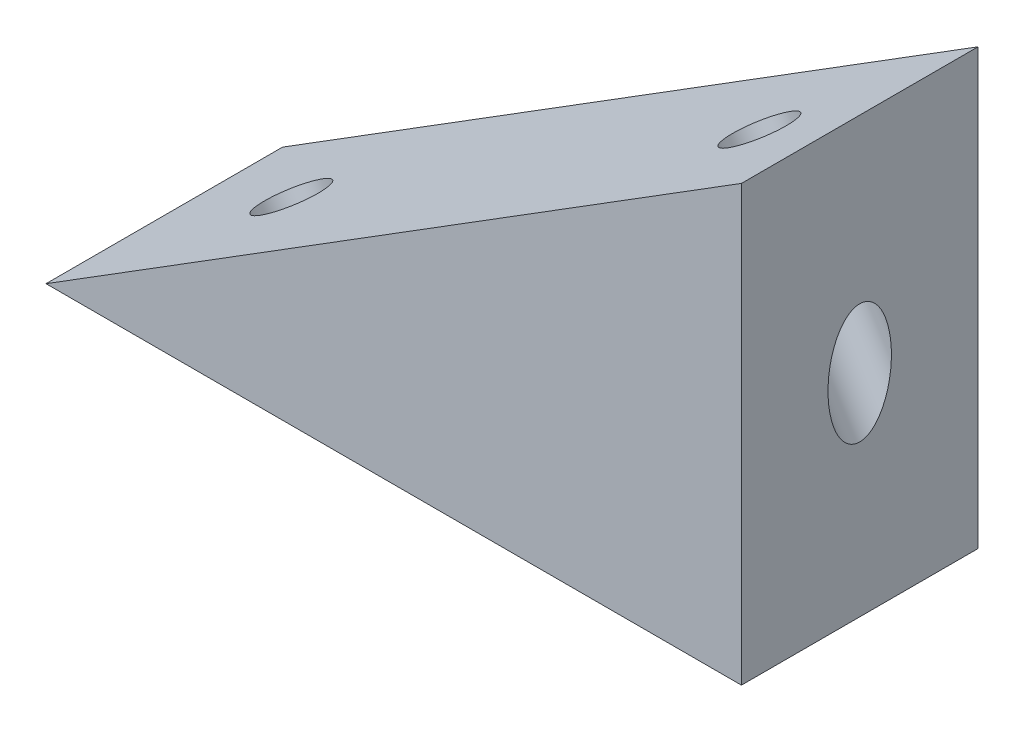
from build123d import *

# Parameters (mm, degrees)
BOSS_EXTRUDE1_DEPTH            = 19.05
F_7_0_201_DIAMETER_HOLE1_D     = 5.1054
F_7_0_201_DIAMETER_HOLE1_DEPTH = 25.4


with BuildPart() as part:
    # Sketch2 → Boss-Extrude1 (new body)
    with BuildSketch(Plane.XY):
        Polygon((0, 0), (0, 34.992683716), (-56.000000014, 0), align=None)
    extrude(amount=BOSS_EXTRUDE1_DEPTH)

    # #7 (0.201) Diameter Hole1
    with Locations(Plane(origin=(-15.725607894, 25.166233303, 0), x_dir=(0.8480480961564308, 0.5299192642331972, 0), z_dir=(-0.5299192642331972, 0.848048096156431, 0))):
        with Locations((-35.431702792, -9.525), (9.018297208, -9.525)):
            Hole(F_7_0_201_DIAMETER_HOLE1_D / 2, depth=F_7_0_201_DIAMETER_HOLE1_DEPTH)


solid = part.part
